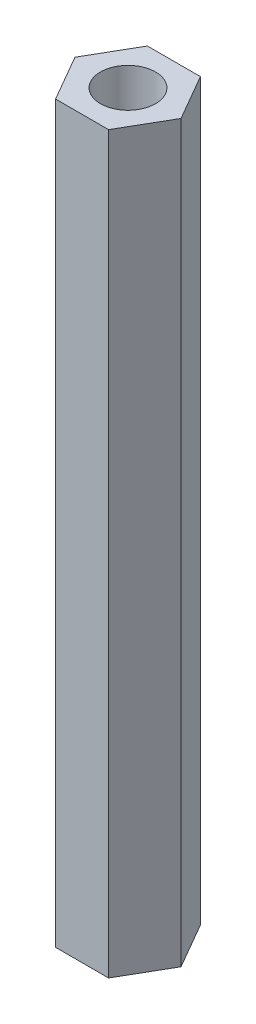
from build123d import *

# Parameters (mm, degrees)
BOSS_EXTRUDE1_DEPTH                        = 20
SKETCH2_R                                  = 1.5
CUT_EXTRUDE1_DEPTH                         = 6
MIRROR1_AT_THE_SECOND_PLANE_COPY_1_SKETC_R = 1.5
MIRROR1_AT_THE_SECOND_PLANE_COPY_1_DEPTH   = 6


with BuildPart() as part:
    # Sketch1 → Boss-Extrude1 (new, symmetric)
    with BuildSketch(Plane(origin=(0, 0, 0), x_dir=(1, 0, 0), z_dir=(0, 1, 0))):
        Polygon((2.886751346, 0), (1.443375673, 2.5), (-1.443375673, 2.5), (-2.886751346, 0), (-1.443375673, -2.5), (1.443375673, -2.5), align=None)
    extrude(amount=BOSS_EXTRUDE1_DEPTH, both=True)

    # Sketch2 → Cut-Extrude1 (cut)
    with BuildSketch(Plane(origin=(0, 20, 0), x_dir=(1, 0, 0), z_dir=(0, 1, 0))):
        with Locations(Location((0, 0, 0), (0, 0, 270))):
            Circle(SKETCH2_R)
    cut_extrude1 = extrude(amount=-CUT_EXTRUDE1_DEPTH, mode=Mode.SUBTRACT)

    # Mirror1: Cut-Extrude1 across plane
    add(cut_extrude1.mirror(Plane(origin=(0, 0, 0), x_dir=(0, 0, 1), z_dir=(1, 0, 0))), mode=Mode.SUBTRACT)

    # Mirror1 at the second plane: Cut-Extrude1 across plane
    add(cut_extrude1.mirror(Plane.ZX), mode=Mode.SUBTRACT)

    # Mirror1 at the second plane copy 1 sketc → Mirror1 at the second plane copy 1 (cut)
    with BuildSketch(Plane(origin=(0, -20, 0), x_dir=(-1, 0, 0), z_dir=(0, -1, 0))):
        with Locations(Location((0, 0, 0), (0, 0, 270))):
            Circle(MIRROR1_AT_THE_SECOND_PLANE_COPY_1_SKETC_R)
    extrude(amount=-MIRROR1_AT_THE_SECOND_PLANE_COPY_1_DEPTH, mode=Mode.SUBTRACT)


solid = part.part
